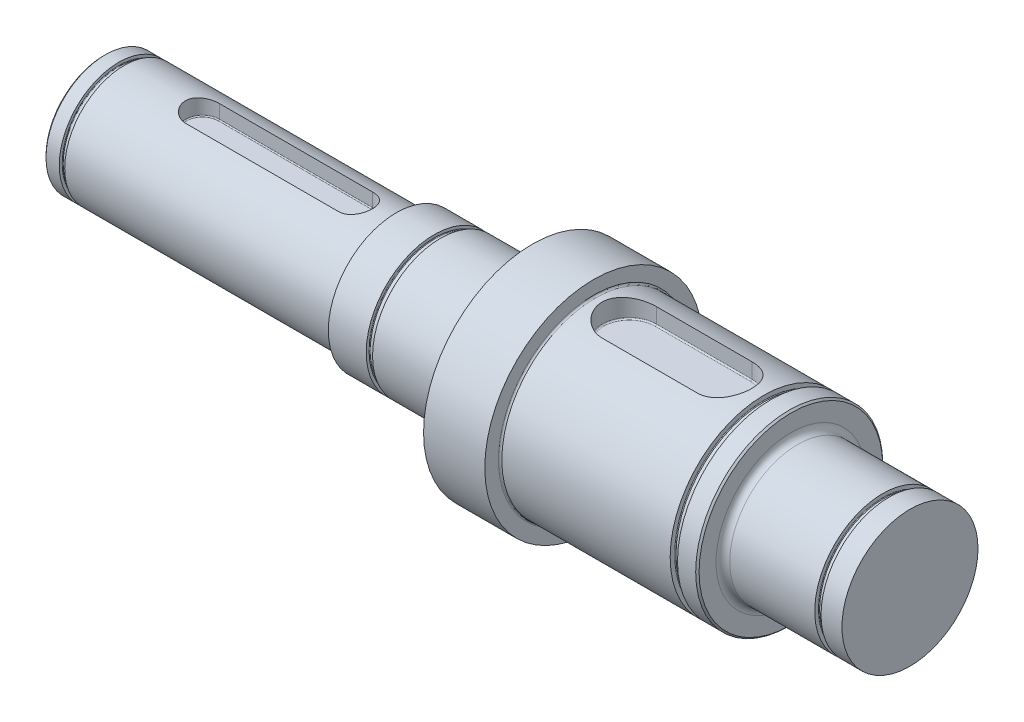
from build123d import *

# Parameters (mm, degrees)
SKETCH1_R               = 32
BOSS_EXTRUDE1_DEPTH     = 112
CUT_EXTRUDE1_START      = -86
SKETCH2_R               = 32
SKETCH2_R_2             = 17.5
CUT_EXTRUDE1_DEPTH      = 86
CUT_EXTRUDE2_START      = -32
SKETCH3_R               = 32
SKETCH3_R_2             = 20
CUT_EXTRUDE2_DEPTH      = 32
SKETCH4_R               = 32
SKETCH4_R_2             = 20
CUT_EXTRUDE3_DEPTH      = 30
SKETCH5_R               = 32
SKETCH5_R_2             = 27.5
CUT_EXTRUDE4_DEPTH      = 58
FILLET1_R               = 2
SKETCH7_W               = 1.85
SKETCH7_H               = 3.319400233
FILLET4_R               = 0.175
SKETCH8_W               = 2.15
SKETCH8_H               = 4.135066137
FILLET5_R               = 0.2
SKETCH9_W               = 1.85
SKETCH9_H               = 3.052950418
FILLET6_R               = 0.175
BOSS_EXTRUDE2_START     = 5
SKETCH10_R              = 20
BOSS_EXTRUDE2_DEPTH     = 5
CUT_EXTRUDE6_REACH      = 139.947
CUT_EXTRUDE6_END_RADIUS = 17.5
CUT_EXTRUDE6_START      = 12.5
FILLET8_R               = 0.3
CUT_EXTRUDE7_REACH      = 148.947
CUT_EXTRUDE7_END_RADIUS = 27.5
CUT_EXTRUDE7_START      = 21.5
FILLET9_R               = 0.4
SKETCH14_R              = 20
BOSS_EXTRUDE3_DEPTH     = 8
SKETCH15_R              = 17.5
BOSS_EXTRUDE4_DEPTH     = 8
SKETCH16_W              = 1.6
SKETCH16_H              = 2.705242986
FILLET10_R              = 0.15
CHAMFER1_SIZE           = 0.5
FILLET11_R              = 1
FILLET12_R              = 0.5


with BuildPart() as part:
    # Sketch1 → Boss-Extrude1 (new, symmetric)
    with BuildSketch(Plane(origin=(0, 0, 0), x_dir=(0, 0, -1), z_dir=(1, 0, 0))):
        Circle(SKETCH1_R)
    extrude(amount=BOSS_EXTRUDE1_DEPTH, both=True)

    # Sketch2 → Cut-Extrude1 (cut)
    with BuildSketch(Plane.ZY.offset(112).offset(CUT_EXTRUDE1_START)):
        Circle(SKETCH2_R)
        Circle(SKETCH2_R_2, mode=Mode.SUBTRACT)
    extrude(amount=CUT_EXTRUDE1_DEPTH, mode=Mode.SUBTRACT)

    # Sketch3 → Cut-Extrude2 (cut)
    with BuildSketch(Plane.ZY.offset(26).offset(CUT_EXTRUDE2_START)):
        Circle(SKETCH3_R)
        Circle(SKETCH3_R_2, mode=Mode.SUBTRACT)
    extrude(amount=CUT_EXTRUDE2_DEPTH, mode=Mode.SUBTRACT)

    # Sketch4 → Cut-Extrude3 (cut)
    with BuildSketch(Plane(origin=(112, 0, 0), x_dir=(0, 0, -1), z_dir=(1, 0, 0))):
        with Locations(Location((0, 0, 0), (0, 0, 180))):
            Circle(SKETCH4_R)
        with Locations(Location((0, 0, 0), (0, 0, 180))):
            Circle(SKETCH4_R_2, mode=Mode.SUBTRACT)
    extrude(amount=-CUT_EXTRUDE3_DEPTH, mode=Mode.SUBTRACT)

    # Sketch5 → Cut-Extrude4 (cut)
    with BuildSketch(Plane(origin=(82, 0, 0), x_dir=(0, 0, -1), z_dir=(1, 0, 0))):
        with Locations(Location((0, 0, 0), (0, 0, 180))):
            Circle(SKETCH5_R)
        Circle(SKETCH5_R_2, mode=Mode.SUBTRACT)
    extrude(amount=-CUT_EXTRUDE4_DEPTH, mode=Mode.SUBTRACT)

    # Fillet1
    fillet1_edges = [part.edges().sort_by_distance(p)[0] for p in [
        (6, 0, -20),
        (82, 0, -20),
    ]]
    fillet(fillet1_edges, radius=FILLET1_R)

    # Sketch7 → Cut-Revolve2 (revolve, cut)
    with BuildSketch(Plane.XY, mode=Mode.PRIVATE) as cut_revolve2_sk:
        with Locations((-21.925, 20.659700116)):
            Rectangle(SKETCH7_W, SKETCH7_H)
    revolve(cut_revolve2_sk.sketch.rotate(Axis((-21.698572551, 0, 0), (-1, 0, 0)), 270), axis=Axis((-21.698572551, 0, 0), (-1, 0, 0)), mode=Mode.SUBTRACT)

    # Fillet4
    fillet4_edges = [part.edges().sort_by_distance(p)[0] for p in [
        (-22.85, 0, -19),
        (-21, 0, -19),
    ]]
    fillet(fillet4_edges, radius=FILLET4_R)

    # Sketch8 → Cut-Revolve3 (revolve, cut)
    with BuildSketch(Plane.XY, mode=Mode.PRIVATE) as cut_revolve3_sk:
        with Locations((75.075, 28.067533069)):
            Rectangle(SKETCH8_W, SKETCH8_H)
    revolve(cut_revolve3_sk.sketch.rotate(Axis((71.197798692, 0, 0), (1, 0, 0)), 270), axis=Axis((71.197798692, 0, 0), (1, 0, 0)), mode=Mode.SUBTRACT)

    # Fillet5
    fillet5_edges = [part.edges().sort_by_distance(p)[0] for p in [
        (74, 0, 26),
        (76.15, 0, 26),
    ]]
    fillet(fillet5_edges, radius=FILLET5_R)

    # Sketch9 → Cut-Revolve4 (revolve, cut)
    with BuildSketch(Plane.XY, mode=Mode.PRIVATE) as cut_revolve4_sk:
        with Locations((109.925, 20.276475209)):
            Rectangle(SKETCH9_W, SKETCH9_H)
    revolve(cut_revolve4_sk.sketch.rotate(Axis((107.700386282, 0, 0), (1, 0, 0)), 270), axis=Axis((107.700386282, 0, 0), (1, 0, 0)), mode=Mode.SUBTRACT)

    # Fillet6
    fillet6_edges = [part.edges().sort_by_distance(p)[0] for p in [
        (109, 0, 18.75),
        (110.85, 0, 18.75),
    ]]
    fillet(fillet6_edges, radius=FILLET6_R)

    # Sketch10 → Boss-Extrude2 (add)
    with BuildSketch(Plane(origin=(112, 0, 0), x_dir=(0, 0, -1), z_dir=(1, 0, 0)).offset(BOSS_EXTRUDE2_START)):
        Circle(SKETCH10_R)
    extrude(amount=-BOSS_EXTRUDE2_DEPTH)

    # Cut-Extrude6: up to this cylinder (the profile starts inside it)
    cut_extrude6_end = Plane(origin=(-68.5, 0, 0), z_dir=(-1, 0, 0)) * Cylinder(CUT_EXTRUDE6_END_RADIUS, 315.894, mode=Mode.PRIVATE)
    # Sketch12 → Cut-Extrude6 (cut, up to the surface)
    with BuildSketch(Plane(origin=(0, 0, 0), x_dir=(1, 0, 0), z_dir=(0, 1, 0)).offset(CUT_EXTRUDE6_START), mode=Mode.PRIVATE) as cut_extrude6_sk1:
        with BuildLine():
            Line((-46, -5), (-91, -5))
            ThreePointArc((-91, -5), (-96, 0), (-91, 5))
            Line((-91, 5), (-46, 5))
            ThreePointArc((-46, 5), (-41, 0), (-46, -5))
        make_face()
    cut_extrude6_tool1 = extrude(cut_extrude6_sk1.sketch, amount=CUT_EXTRUDE6_REACH, mode=Mode.PRIVATE) & cut_extrude6_end
    add(cut_extrude6_tool1.solids().sort_by_distance((-68.5, 12.5, 0))[0], mode=Mode.SUBTRACT)

    # Fillet8
    fillet8_edges = [part.edges().sort_by_distance(p)[0] for p in [
        (-96, 12.5, 0),
        (-68.5, 12.5, 5),
        (-41, 12.5, 0),
        (-68.5, 12.5, -5),
    ]]
    fillet(fillet8_edges, radius=FILLET8_R)

    # Cut-Extrude7: up to this cylinder (the profile starts inside it)
    cut_extrude7_end = Plane(origin=(48.5, 0, 0), z_dir=(1, 0, 0)) * Cylinder(CUT_EXTRUDE7_END_RADIUS, 353.894, mode=Mode.PRIVATE)
    # Sketch13 → Cut-Extrude7 (cut, up to the surface)
    with BuildSketch(Plane(origin=(0, 0, 0), x_dir=(1, 0, 0), z_dir=(0, 1, 0)).offset(CUT_EXTRUDE7_START), mode=Mode.PRIVATE) as cut_extrude7_sk1:
        with BuildLine():
            Line((34.5, -8), (62.5, -8))
            ThreePointArc((62.5, -8), (70.5, 0), (62.5, 8))
            Line((62.5, 8), (34.5, 8))
            ThreePointArc((34.5, 8), (26.5, 0), (34.5, -8))
        make_face()
    cut_extrude7_tool1 = extrude(cut_extrude7_sk1.sketch, amount=CUT_EXTRUDE7_REACH, mode=Mode.PRIVATE) & cut_extrude7_end
    add(cut_extrude7_tool1.solids().sort_by_distance((48.5, 21.5, 0))[0], mode=Mode.SUBTRACT)

    # Fillet9
    fillet9_edges = [part.edges().sort_by_distance(p)[0] for p in [
        (70.5, 21.5, 0),
        (48.5, 21.5, -8),
        (26.5, 21.5, 0),
        (48.5, 21.5, 8),
    ]]
    fillet(fillet9_edges, radius=FILLET9_R)

    # Sketch14 → Boss-Extrude3 (add)
    with BuildSketch(Plane.ZY.offset(26)):
        with Locations(Location((0, 0, 0), (0, 0, 180))):
            Circle(SKETCH14_R)
    extrude(amount=BOSS_EXTRUDE3_DEPTH)

    # Sketch15 → Boss-Extrude4 (add)
    with BuildSketch(Plane.ZY.offset(112)):
        Circle(SKETCH15_R)
    extrude(amount=BOSS_EXTRUDE4_DEPTH)

    # Sketch16 → Cut-Revolve5 (revolve, cut)
    with BuildSketch(Plane.XY, mode=Mode.PRIVATE) as cut_revolve5_sk:
        with Locations((-114.8, 17.852621493)):
            Rectangle(SKETCH16_W, SKETCH16_H)
    revolve(cut_revolve5_sk.sketch.rotate(Axis((-114, 0, 0), (1, 0, 0)), 90), axis=Axis((-114, 0, 0), (1, 0, 0)), mode=Mode.SUBTRACT)

    # Fillet10
    fillet10_edges = [part.edges().sort_by_distance(p)[0] for p in [
        (-115.6, 0, -16.5),
        (-114, 0, -16.5),
    ]]
    fillet(fillet10_edges, radius=FILLET10_R)

    # Chamfer1
    chamfer1_edges = [part.edges().sort_by_distance(p)[0] for p in [
        (-120, 0, -17.5),
        (82, 0, 27.5),
    ]]
    chamfer(chamfer1_edges, length=CHAMFER1_SIZE)

    # Fillet11
    fillet11_edges = [part.edges().sort_by_distance(p)[0] for p in [
        (-34, 0, -17.5),
    ]]
    fillet(fillet11_edges, radius=FILLET11_R)

    # Fillet12
    fillet12_edges = [part.edges().sort_by_distance(p)[0] for p in [
        (24, 0, 27.5),
    ]]
    fillet(fillet12_edges, radius=FILLET12_R)


solid = part.part
